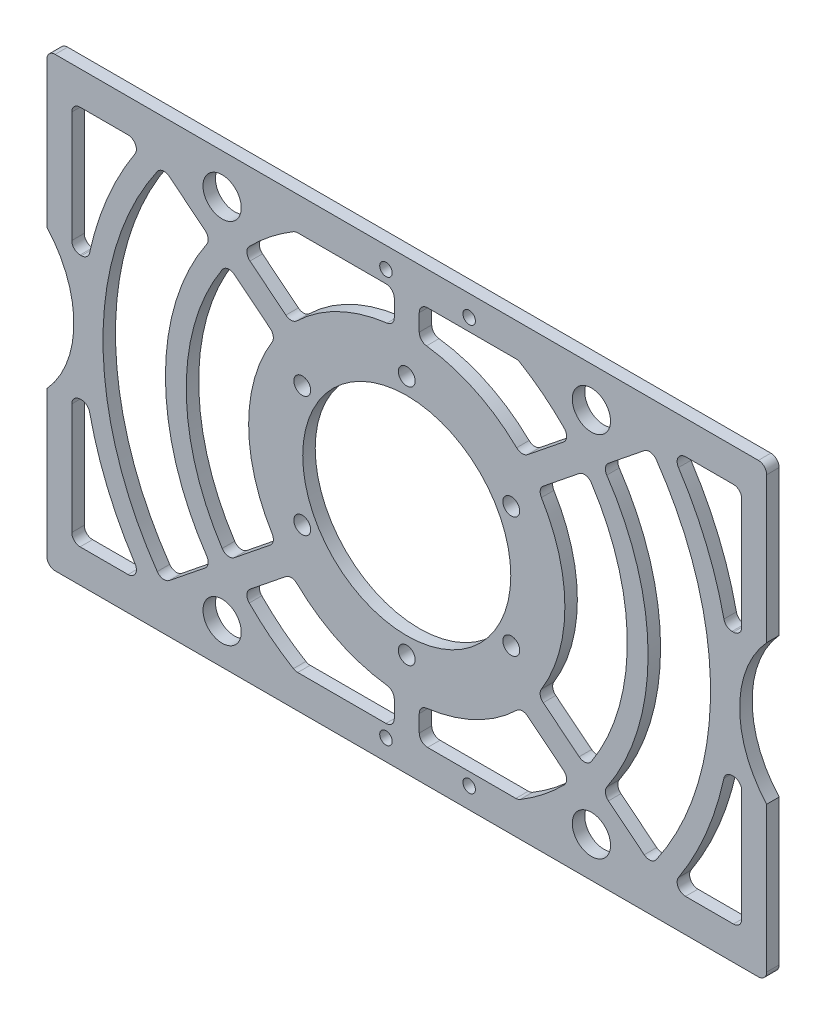
from build123d import *

# Parameters (mm, degrees)
SKETCH_1_W            = 284
SKETCH_1_H            = 107.5
EXTRUDE_1_DEPTH       = 1.5
SKETCH_2_W            = 55.5
SKETCH_2_H            = 107.5
CUT_EXTRUDE_1_DEPTH   = 10
SKETCH_4_R            = 2.025
SKETCH_4_R_2          = 25
CUT_EXTRUDE_2_DEPTH   = 10
FILLET_1_R            = 2
SKETCH_5_R            = 25
CUT_EXTRUDE_3_DEPTH   = 10
CUT_EXTRUDE_4_DEPTH   = 10
SKETCH_7_R            = 4.597187738
CUT_EXTRUDE_5_DEPTH   = 10
CUT_EXTRUDE_6_DEPTH   = 10
MIRROR_3_COPY_1_DEPTH = 10
FILLET_2_R            = 2
SKETCH_10_R           = 1.5
CUT_EXTRUDE_7_DEPTH   = 10


with BuildPart() as part:
    # 草图1 → 凸台-拉伸1 (new, symmetric)
    with BuildSketch(Plane.XY):
        Rectangle(SKETCH_1_W, SKETCH_1_H)
    extrude(amount=EXTRUDE_1_DEPTH, both=True)

    # 草图2 → 切除-拉伸1 (cut)
    with BuildSketch(Plane.XY.offset(1.5)):
        with Locations((-114.25, 0)):
            Rectangle(SKETCH_2_W, SKETCH_2_H)
        with Locations((114.25, 0)):
            Rectangle(SKETCH_2_W, SKETCH_2_H)
    extrude(amount=-CUT_EXTRUDE_1_DEPTH, mode=Mode.SUBTRACT)

    # 草图4 → 切除-拉伸2 (cut)
    with BuildSketch(Plane.XY.offset(1.5)):
        with Locations((0, 29)):
            Circle(SKETCH_4_R)
        with Locations((25.11473671, 14.5)):
            Circle(SKETCH_4_R)
        with Locations((25.11473671, -14.5)):
            Circle(SKETCH_4_R)
        with Locations((0, -29)):
            Circle(SKETCH_4_R)
        with Locations((-25.11473671, -14.5)):
            Circle(SKETCH_4_R)
        with Locations((-25.11473671, 14.5)):
            Circle(SKETCH_4_R)
        Circle(SKETCH_4_R_2)
    extrude(amount=-CUT_EXTRUDE_2_DEPTH, mode=Mode.SUBTRACT)

    # 圆角1
    fillet_1_edges = [part.edges().sort_by_distance(p)[0] for p in [
        (-86.5, 53.75, 0),
        (-86.5, -53.75, 0),
        (86.5, -53.75, 0),
        (86.5, 53.75, 0),
    ]]
    fillet(fillet_1_edges, radius=FILLET_1_R)

    # 草图5 → 切除-拉伸3 (cut)
    with BuildSketch(Plane.XY.offset(1.5)):
        with Locations((-105, 0)):
            Circle(SKETCH_5_R)
    cut_extrude_3 = extrude(amount=-CUT_EXTRUDE_3_DEPTH, mode=Mode.SUBTRACT)

    # 镜向1: 切除-拉伸3 across plane
    add(cut_extrude_3.mirror(Plane(origin=(0, 0, 0), x_dir=(0, 0, 1), z_dir=(1, 0, 0))), mode=Mode.SUBTRACT)

    # 草图6 → 切除-拉伸4 (cut)
    with BuildSketch(Plane.XY.offset(1.5)):
        with BuildLine():
            ThreePointArc((-47.016178119, -33.962906164), (-58, 0), (-47.016178119, 33.962906164))
            Line((-47.016178119, 33.962906164), (-58.71738195, 43.373598616))
            ThreePointArc((-58.71738195, 43.373598616), (-73, 0), (-58.71738195, -43.373598616))
            Line((-58.71738195, -43.373598616), (-47.016178119, -33.962906164))
        make_face()
        with BuildLine():
            Line((-31.399239746, 21.40298445), (-43.114208329, 30.824747203))
            ThreePointArc((-43.114208329, 30.824747203), (-53, 0), (-43.114208329, -30.824747203))
            Line((-43.114208329, -30.824747203), (-31.399239746, -21.40298445))
            ThreePointArc((-31.399239746, -21.40298445), (-38, 0), (-31.399239746, 21.40298445))
        make_face()
        with BuildLine():
            Line((-3, 45.75), (-26.757008428, 45.75))
            ThreePointArc((-26.757008428, 45.75), (-33.450389018, 41.11047889), (-39.353934357, 35.500251417))
            Line((-39.353934357, 35.500251417), (-27.638965774, 26.078488663))
            ThreePointArc((-27.638965774, 26.078488663), (-16.416872377, 34.270779118), (-3, 37.88139385))
            Line((-3, 37.88139385), (-3, 45.75))
        make_face()
        with BuildLine():
            Line((26.757008428, 45.75), (3, 45.75))
            Line((3, 45.75), (3, 37.88139385))
            ThreePointArc((3, 37.88139385), (16.416872377, 34.270779118), (27.638965774, 26.078488663))
            Line((27.638965774, 26.078488663), (39.353934357, 35.500251417))
            ThreePointArc((39.353934357, 35.500251417), (33.450389018, 41.11047889), (26.757008428, 45.75))
        make_face()
        with BuildLine():
            ThreePointArc((43.114208329, -30.824747203), (53, 0), (43.114208329, 30.824747203))
            Line((43.114208329, 30.824747203), (31.399239746, 21.40298445))
            ThreePointArc((31.399239746, 21.40298445), (36.312333376, 11.198859086), (38, 0))
            ThreePointArc((38, 0), (36.312333376, -11.198859086), (31.399239746, -21.40298445))
            Line((31.399239746, -21.40298445), (43.114208329, -30.824747203))
        make_face()
        with BuildLine():
            ThreePointArc((26.757008428, -45.75), (33.450389018, -41.11047889), (39.353934357, -35.500251417))
            Line((39.353934357, -35.500251417), (27.638965774, -26.078488663))
            ThreePointArc((27.638965774, -26.078488663), (16.416872377, -34.270779118), (3, -37.88139385))
            Line((3, -37.88139385), (3, -45.75))
            Line((3, -45.75), (26.757008428, -45.75))
        make_face()
        with BuildLine():
            Line((-27.638965774, -26.078488663), (-39.353934357, -35.500251417))
            ThreePointArc((-39.353934357, -35.500251417), (-33.450389018, -41.11047889), (-26.757008428, -45.75))
            Line((-26.757008428, -45.75), (-3, -45.75))
            Line((-3, -45.75), (-3, -37.88139385))
            ThreePointArc((-3, -37.88139385), (-16.416872377, -34.270779118), (-27.638965774, -26.078488663))
        make_face()
        with BuildLine():
            Line((58.71738195, 43.373598616), (47.016178119, 33.962906164))
            ThreePointArc((47.016178119, 33.962906164), (58, 0), (47.016178119, -33.962906164))
            Line((47.016178119, -33.962906164), (58.71738195, -43.373598616))
            ThreePointArc((58.71738195, -43.373598616), (73, 0), (58.71738195, 43.373598616))
        make_face()
    extrude(amount=-CUT_EXTRUDE_4_DEPTH, mode=Mode.SUBTRACT)

    # 草图7 → 切除-拉伸5 (cut)
    with BuildSketch(Plane.XY.offset(1.5)):
        with Locations((44.372706499, -44.152812262)):
            Circle(SKETCH_7_R)
        with Locations(Location((-44.372706499, -44.152812262, 0), (0, 0, 180))):
            Circle(SKETCH_7_R)
        with Locations((-44.372706499, 44.152812262)):
            Circle(SKETCH_7_R)
        with Locations(Location((44.372706499, 44.152812262, 0), (0, 0, 180))):
            Circle(SKETCH_7_R)
    extrude(amount=-CUT_EXTRUDE_5_DEPTH, mode=Mode.SUBTRACT)

    # 草图8 → 切除-拉伸6 (cut)
    with BuildSketch(Plane.XY.offset(1.5)):
        with BuildLine():
            Line((-80.5, 45.75), (-80.5, 15))
            Line((-80.5, 15), (-76.544104933, 15))
            ThreePointArc((-76.544104933, 15), (-71.530892354, 31.101952336), (-63.173867224, 45.75))
            Line((-63.173867224, 45.75), (-80.5, 45.75))
        make_face()
    cut_extrude_6 = extrude(amount=-CUT_EXTRUDE_6_DEPTH, mode=Mode.SUBTRACT)

    # 镜向2: 切除-拉伸6 across plane
    add(cut_extrude_6.mirror(Plane(origin=(0, 0, 0), x_dir=(0, 0, 1), z_dir=(1, 0, 0))), mode=Mode.SUBTRACT)

    # 镜向3: 切除-拉伸6 across plane
    add(cut_extrude_6.mirror(Plane.ZX), mode=Mode.SUBTRACT)

    # 镜向3 copy 1 sketch → 镜向3 copy 1 (cut)
    with BuildSketch(Plane(origin=(0, 0, 1.5), x_dir=(-1, 0, 0), z_dir=(0, 0, 1))):
        with BuildLine():
            Line((-80.5, 45.75), (-80.5, 15))
            Line((-80.5, 15), (-76.544104933, 15))
            ThreePointArc((-76.544104933, 15), (-71.530892354, 31.101952336), (-63.173867224, 45.75))
            Line((-63.173867224, 45.75), (-80.5, 45.75))
        make_face()
    extrude(amount=-MIRROR_3_COPY_1_DEPTH, mode=Mode.SUBTRACT)

    # 圆角2
    fillet_2_edges = [part.edges().sort_by_distance(p)[0] for p in [
        (-26.757008428, 45.75, 0),
        (-3, 45.75, 0),
        (-3, 37.88139385, 0),
        (-27.638965774, 26.078488663, 0),
        (-39.353934357, 35.500251417, 0),
        (-43.114208329, 30.824747203, 0),
        (-31.399239746, 21.40298445, 0),
        (-31.399239746, -21.40298445, 0),
        (-43.114208329, -30.824747203, 0),
        (43.114208329, -30.824747203, 0),
        (31.399239746, -21.40298445, 0),
        (31.399239746, 21.40298445, 0),
        (43.114208329, 30.824747203, 0),
        (39.353934357, 35.500251417, 0),
        (27.638965774, 26.078488663, 0),
        (3, 37.88139385, 0),
        (3, 45.75, 0),
        (26.757008428, 45.75, 0),
        (26.757008428, -45.75, 0),
        (3, -45.75, 0),
        (3, -37.88139385, 0),
        (27.638965774, -26.078488663, 0),
        (39.353934357, -35.500251417, 0),
        (-39.353934357, -35.500251417, 0),
        (-27.638965774, -26.078488663, 0),
        (-3, -37.88139385, 0),
        (-3, -45.75, 0),
        (-26.757008428, -45.75, 0),
        (58.71738195, -43.373598616, 0),
        (47.016178119, -33.962906164, 0),
        (47.016178119, 33.962906164, 0),
        (58.71738195, 43.373598616, 0),
        (-47.016178119, 33.962906164, 0),
        (-47.016178119, -33.962906164, 0),
        (-58.71738195, -43.373598616, 0),
        (-58.71738195, 43.373598616, 0),
        (-80.5, 45.75, 0),
        (-63.173867224, 45.75, 0),
        (-76.544104933, 15, 0),
        (-80.5, 15, 0),
        (63.173867224, 45.75, 0),
        (80.5, 45.75, 0),
        (80.5, 15, 0),
        (76.544104933, 15, 0),
        (80.5, -45.75, 0),
        (63.173867224, -45.75, 0),
        (76.544104933, -15, 0),
        (80.5, -15, 0),
        (-63.173867224, -45.75, 0),
        (-80.5, -45.75, 0),
        (-80.5, -15, 0),
        (-76.544104933, -15, 0),
    ]]
    fillet(fillet_2_edges, radius=FILLET_2_R)

    # 草图10 → 切除-拉伸7 (cut)
    with BuildSketch(Plane.XY.offset(1.5)):
        with Locations((-5, 48.75)):
            Circle(SKETCH_10_R)
        with Locations((15, 48.75)):
            Circle(SKETCH_10_R)
        with Locations(Location((15, -48.75, 0), (0, 0, 180))):
            Circle(SKETCH_10_R)
        with Locations(Location((-5, -48.75, 0), (0, 0, 180))):
            Circle(SKETCH_10_R)
    extrude(amount=-CUT_EXTRUDE_7_DEPTH, mode=Mode.SUBTRACT)


solid = part.part
